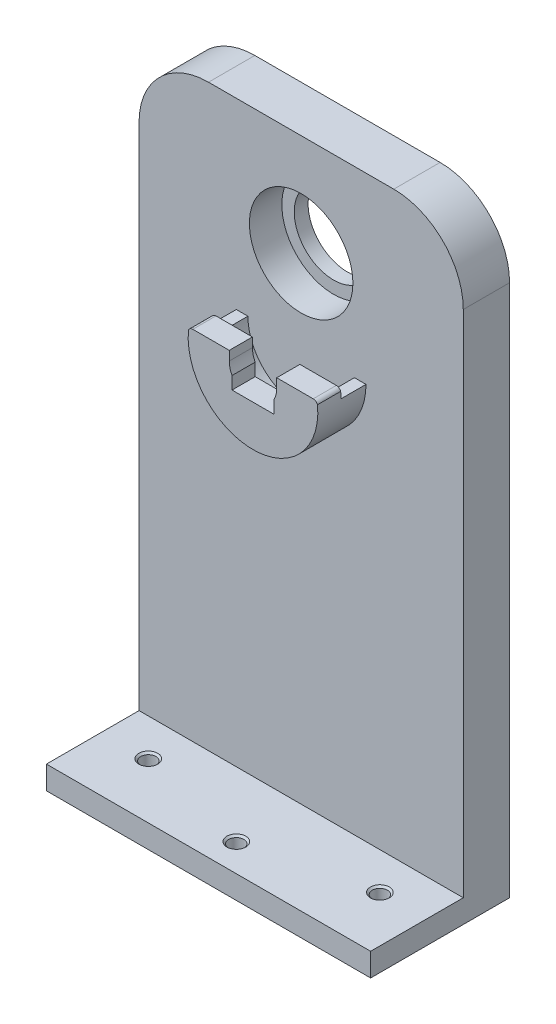
from build123d import *

# Parameters (mm, degrees)
SKETCH2_R           = 8.5
BOSS_EXTRUDE1_DEPTH = 10
SKETCH3_R           = 11.175
CUT_EXTRUDE1_DEPTH  = 7
SKETCH4_W           = 70
SKETCH4_H           = 5
BOSS_EXTRUDE3_DEPTH = 20
SKETCH5_R           = 1.64
CUT_EXTRUDE2_DEPTH  = 20
CHAMFER1_SIZE       = 0.4
CHAMFER3_SIZE       = 0.4
BOSS_EXTRUDE4_DEPTH = 5.4
BOSS_EXTRUDE5_DEPTH = 5


with BuildPart() as part:
    # Sketch2 → Boss-Extrude1 (new body)
    with BuildSketch(Plane.XY):
        with BuildLine():
            Line((0, 0), (-70, 0))
            Line((-70, 0), (-70, 115))
            ThreePointArc((-70, 115), (-65.606601718, 125.606601718), (-55, 130))
            Line((-55, 130), (-15, 130))
            ThreePointArc((-15, 130), (-4.393398282, 125.606601718), (0, 115))
            Line((0, 115), (0, 0))
        make_face()
        with Locations((-35, 108)):
            Circle(SKETCH2_R, mode=Mode.SUBTRACT)
    extrude(amount=BOSS_EXTRUDE1_DEPTH)

    # Sketch3 → Cut-Extrude1 (cut)
    with BuildSketch(Plane.XY.offset(10)):
        with Locations((-35, 108)):
            Circle(SKETCH3_R)
    extrude(amount=-CUT_EXTRUDE1_DEPTH, mode=Mode.SUBTRACT)

    # Sketch4 → Boss-Extrude3 (add)
    with BuildSketch(Plane.XY.offset(10)):
        with Locations((-35, 2.5)):
            Rectangle(SKETCH4_W, SKETCH4_H)
    extrude(amount=BOSS_EXTRUDE3_DEPTH)

    # Sketch5 → Cut-Extrude2 (cut)
    with BuildSketch(Plane(origin=(0, 5, 0), x_dir=(1, 0, 0), z_dir=(0, 1, 0))):
        with Locations(Location((-60, -18, 0), (0, 0, 270))):
            Circle(SKETCH5_R)
        with Locations(Location((-35, -24, 0), (0, 0, 270))):
            Circle(SKETCH5_R)
        with Locations(Location((-10, -18, 0), (0, 0, 270))):
            Circle(SKETCH5_R)
    extrude(amount=-CUT_EXTRUDE2_DEPTH, mode=Mode.SUBTRACT)

    # Chamfer1
    chamfer1_edges = [part.edges().sort_by_distance(p)[0] for p in [
        (-35, 5, 22.36),
    ]]
    chamfer(chamfer1_edges, length=CHAMFER1_SIZE)

    # Chamfer3
    chamfer3_edges = [part.edges().sort_by_distance(p)[0] for p in [
        (-60, 5, 16.36),
        (-10, 5, 16.36),
    ]]
    chamfer(chamfer3_edges, length=CHAMFER3_SIZE)

    # Sketch6 → Boss-Extrude4 (add)
    with BuildSketch(Plane.XY.offset(10)):
        with BuildLine():
            Line((-21, 90.5), (-23.5, 90.5))
            ThreePointArc((-23.5, 90.5), (-35, 79), (-46.5, 90.5))
            Line((-46.5, 90.5), (-49, 90.5))
            ThreePointArc((-49, 90.5), (-35, 76.5), (-21, 90.5))
        make_face()
    extrude(amount=BOSS_EXTRUDE4_DEPTH)

    # Sketch7 → Boss-Extrude5 (add)
    with BuildSketch(Plane.XY.offset(15.4)):
        with BuildLine():
            ThreePointArc((-23.5, 90.5), (-35, 79), (-46.5, 90.5))
            Line((-46.5, 90.5), (-49, 90.5))
            ThreePointArc((-49, 90.5), (-35, 76.5), (-21, 90.5))
            Line((-21, 90.5), (-23.5, 90.5))
        make_face()
        with BuildLine():
            Line((-40.125, 90.5), (-46.5, 90.5))
            ThreePointArc((-46.5, 90.5), (-35, 79), (-23.5, 90.5))
            Line((-23.5, 90.5), (-29.875, 90.5))
            ThreePointArc((-29.875, 90.5), (-30.027261821, 89.260040323), (-30.475, 88.093758117))
            Line((-30.475, 88.093758117), (-30.475, 85.375))
            Line((-30.475, 85.375), (-35, 85.375))
            Line((-35, 85.375), (-39.525, 85.375))
            Line((-39.525, 85.375), (-39.525, 88.093758117))
            ThreePointArc((-39.525, 88.093758117), (-39.972738179, 89.260040323), (-40.125, 90.5))
        make_face()
        with BuildLine():
            ThreePointArc((-48.934070004, 91.857089942), (-48.983507787, 91.17934525), (-49, 90.5))
            Line((-49, 90.5), (-46.5, 90.5))
            Line((-46.5, 90.5), (-40.125, 90.5))
            Line((-40.125, 90.5), (-40.125, 92.5))
            Line((-40.125, 92.5), (-48, 92.5))
            ThreePointArc((-48, 92.5), (-48.566970042, 92.323738412), (-48.934070004, 91.857089942))
        make_face()
        with BuildLine():
            Line((-23.5, 90.5), (-21, 90.5))
            ThreePointArc((-21, 90.5), (-21.016492213, 91.17934525), (-21.065929996, 91.857089942))
            ThreePointArc((-21.065929996, 91.857089942), (-21.433029958, 92.323738412), (-22, 92.5))
            Line((-22, 92.5), (-29.875, 92.5))
            Line((-29.875, 92.5), (-29.875, 90.5))
            Line((-29.875, 90.5), (-23.5, 90.5))
        make_face()
    extrude(amount=BOSS_EXTRUDE5_DEPTH)


solid = part.part
